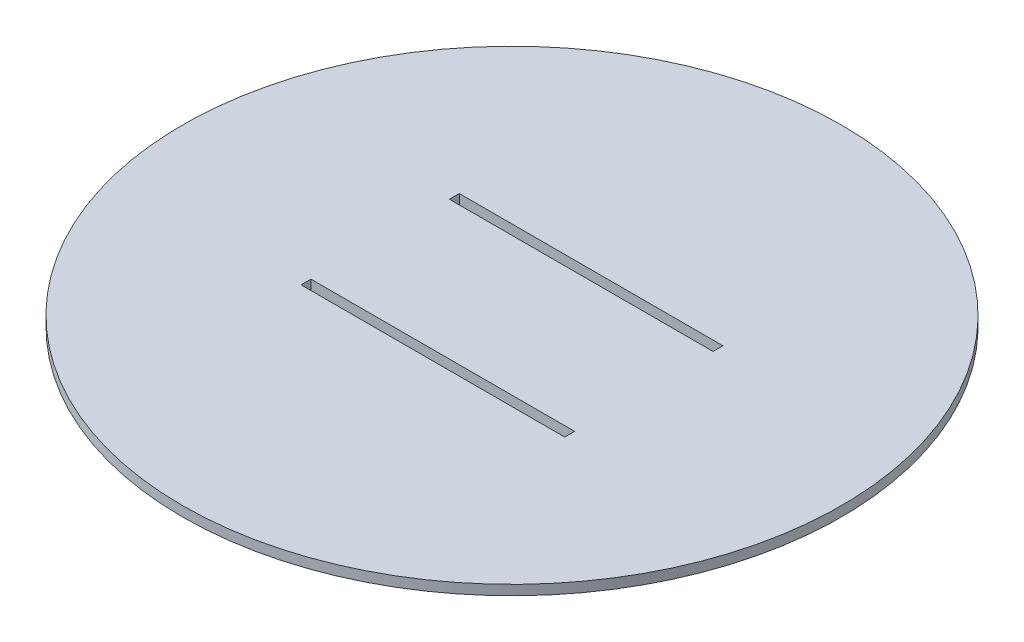
from build123d import *

# Parameters (mm, degrees)
SKETCH1_R           = 100
SKETCH1_W           = 80
SKETCH1_H           = 3
BOSS_EXTRUDE1_DEPTH = 3


with BuildPart() as part:
    # Sketch1 → Boss-Extrude1 (new body)
    with BuildSketch(Plane(origin=(0, 0, 0), x_dir=(1, 0, 0), z_dir=(0, 1, 0))):
        with Locations(Location((0, 0, 0), (0, 0, 270))):
            Circle(SKETCH1_R)
        with Locations((0, -22.5)):
            Rectangle(SKETCH1_W, SKETCH1_H, mode=Mode.SUBTRACT)
        with Locations((0, 22.5)):
            Rectangle(SKETCH1_W, SKETCH1_H, mode=Mode.SUBTRACT)
    extrude(amount=BOSS_EXTRUDE1_DEPTH)


solid = part.part
